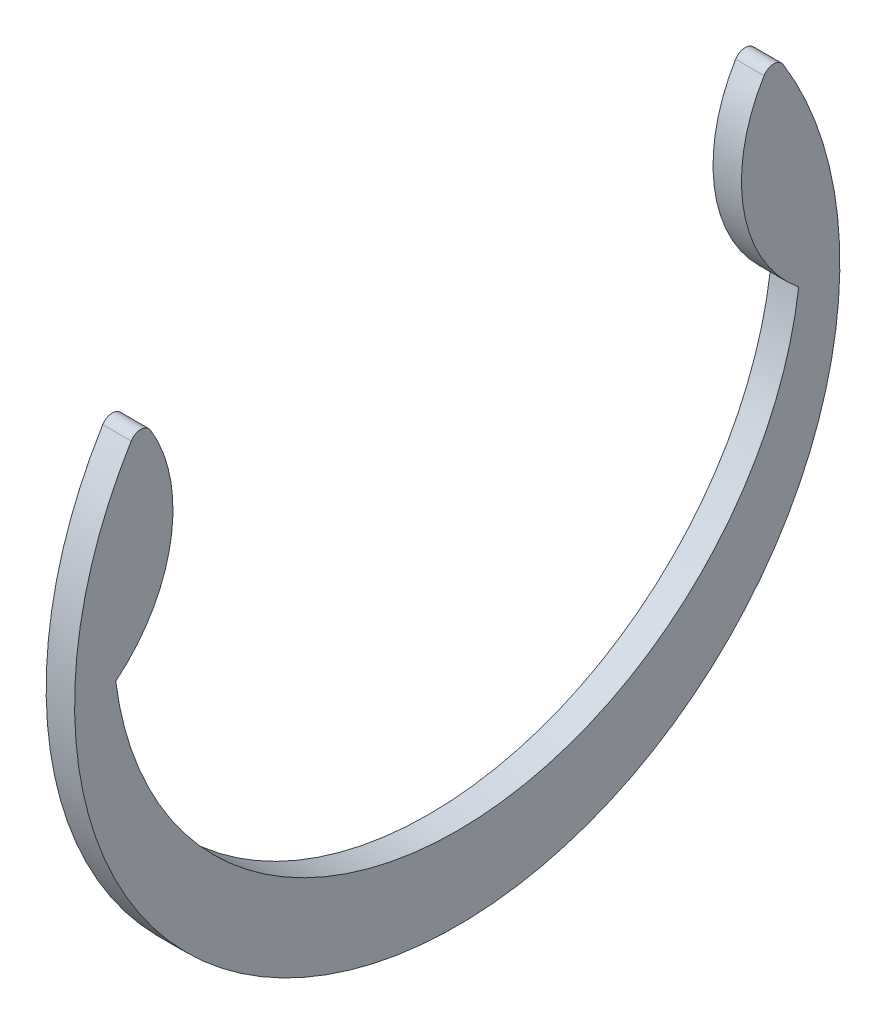
from build123d import *

# Parameters (mm, degrees)
EXTRUDE1_DEPTH = 0.5334


with BuildPart() as part:
    # Sketch1 → Extrude1 (new, symmetric)
    with BuildSketch(Plane(origin=(0, 0, 0), x_dir=(0, 0, -1), z_dir=(1, 0, 0))):
        with BuildLine():
            ThreePointArc((-12.80795, 0), (0, -11.2649), (12.80795, 0))
            ThreePointArc((12.80795, 0), (10.74595989, 3.509932598), (11.507411117, 7.508885221))
            ThreePointArc((11.507411117, 7.508885221), (11.867986747, 7.711626094), (12.229149698, 7.509933333))
            ThreePointArc((12.229149698, 7.509933333), (0, -14.351), (-12.229149698, 7.509933333))
            ThreePointArc((-12.229149698, 7.509933333), (-11.867986747, 7.711626094), (-11.507411117, 7.508885221))
            ThreePointArc((-11.507411117, 7.508885221), (-10.74595989, 3.509932598), (-12.80795, 0))
        make_face()
    extrude(amount=EXTRUDE1_DEPTH, both=True)


solid = part.part
